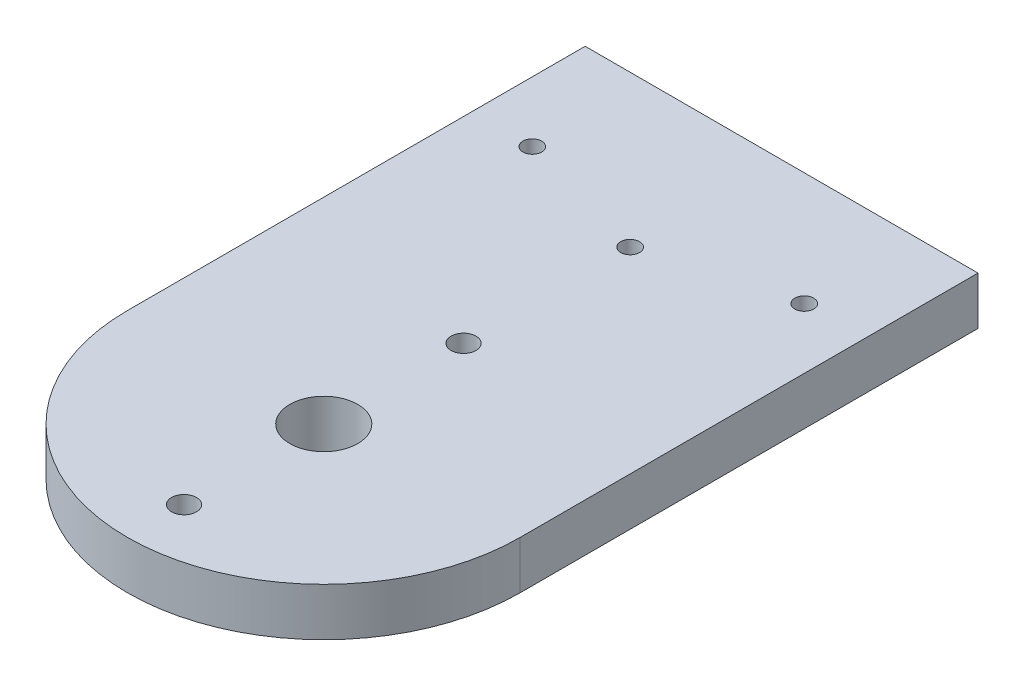
from build123d import *

# Parameters (mm, degrees)
PARED_B_CHUMACERA_J5_START          = -10.525
CROQUIS1_W                          = 52
CROQUIS1_H                          = 60.6
PARED_B_CHUMACERA_J5_DEPTH          = 6.35
PARED_B_CHUMACERA_J5_REDONDEO_START = -10.525
CROQUIS2_R                          = 26
PARED_B_CHUMACERA_J5_REDONDEO_DEPTH = 6.35
PASO_PERNO_Y_ROSCA_M4_KFL08_START   = -10.525
CROQUIS3_R                          = 4.5
CROQUIS3_R_2                        = 1.65
PASO_PERNO_Y_ROSCA_M4_KFL08_DEPTH   = 6.35
ROSCA_M3_ESCUADRAS_START            = -10.525
CROQUIS4_R                          = 1.25
ROSCA_M3_ESCUADRAS_DEPTH            = 6.35
PASADORES_D4_START                  = 275.95
CROQUIS5_R                          = 2
PASADORES_D4_DEPTH                  = 8
ROSCA_M3_BASES_CINCHO_START         = -10.525
CROQUIS6_R                          = 1.25
ROSCA_M3_BASES_CINCHO_DEPTH         = 6.35


with BuildPart() as part:
    # Croquis1 → Pared_B_chumacera_J5 (new body)
    with BuildSketch(Plane(origin=(0, 0, 0), x_dir=(1, 0, 0), z_dir=(0, 1, 0)).offset(PARED_B_CHUMACERA_J5_START)):
        with Locations((152.4, -306.25)):
            Rectangle(CROQUIS1_W, CROQUIS1_H)
    extrude(amount=PARED_B_CHUMACERA_J5_DEPTH)

    # Croquis2 → Pared_B_chumacera_J5_redondeo (add)
    with BuildSketch(Plane(origin=(0, 0, 0), x_dir=(1, 0, 0), z_dir=(0, 1, 0)).offset(PARED_B_CHUMACERA_J5_REDONDEO_START)):
        with Locations((152.4, -336.55)):
            Circle(CROQUIS2_R)
    extrude(amount=PARED_B_CHUMACERA_J5_REDONDEO_DEPTH)

    # Croquis3 → Paso_perno_y_rosca_M4_KFL08 (cut)
    with BuildSketch(Plane(origin=(0, 0, 0), x_dir=(1, 0, 0), z_dir=(0, 1, 0)).offset(PASO_PERNO_Y_ROSCA_M4_KFL08_START)):
        with Locations(Location((152.4, -336.55, 0), (0, 0, 90))):
            Circle(CROQUIS3_R)
        with Locations(Location((152.4, -355.05, 0), (0, 0, 90))):
            Circle(CROQUIS3_R_2)
        with Locations(Location((152.4, -318.05, 0), (0, 0, 90))):
            Circle(CROQUIS3_R_2)
    extrude(amount=PASO_PERNO_Y_ROSCA_M4_KFL08_DEPTH, mode=Mode.SUBTRACT)

    # Croquis4 → Rosca_M3_escuadras (cut)
    with BuildSketch(Plane(origin=(0, 0, 0), x_dir=(1, 0, 0), z_dir=(0, 1, 0)).offset(ROSCA_M3_ESCUADRAS_START)):
        with Locations(Location((134.4, -290.95, 0), (0, 0, 90))):
            Circle(CROQUIS4_R)
        with Locations(Location((170.4, -290.95, 0), (0, 0, 90))):
            Circle(CROQUIS4_R)
    extrude(amount=ROSCA_M3_ESCUADRAS_DEPTH, mode=Mode.SUBTRACT)

    # Croquis5 → Pasadores_D4 (cut)
    with BuildSketch(Plane.XY.offset(PASADORES_D4_START)):
        with Locations((130.4, -7.35)):
            Circle(CROQUIS5_R)
        with Locations((174.4, -7.35)):
            Circle(CROQUIS5_R)
    extrude(amount=PASADORES_D4_DEPTH, mode=Mode.SUBTRACT)

    # Croquis6 → Rosca_M3_bases_cincho (cut)
    with BuildSketch(Plane(origin=(0, 0, 0), x_dir=(1, 0, 0), z_dir=(0, 1, 0)).offset(ROSCA_M3_BASES_CINCHO_START)):
        with Locations(Location((152.4, -296, 0), (0, 0, 90))):
            Circle(CROQUIS6_R)
    extrude(amount=ROSCA_M3_BASES_CINCHO_DEPTH, mode=Mode.SUBTRACT)


solid = part.part
